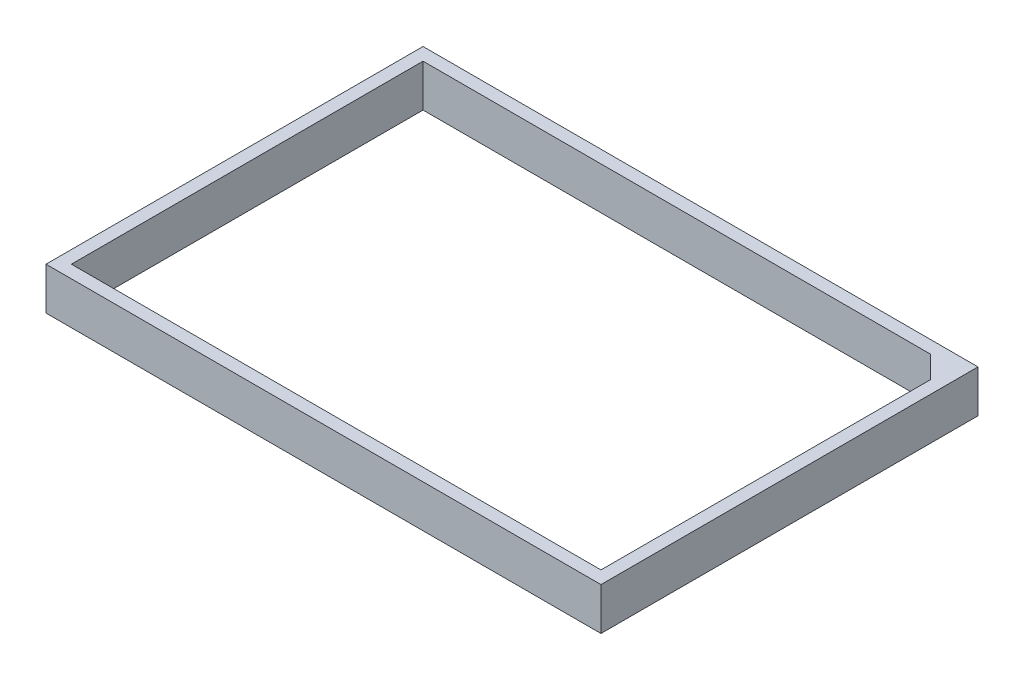
from build123d import *

# Parameters (mm, degrees)
SKETCH1_W           = 131
SKETCH1_H           = 89
BOSS_EXTRUDE1_DEPTH = 10
CUT_EXTRUDE1_DEPTH  = 100


with BuildPart() as part:
    # Sketch1 → Boss-Extrude1 (new body)
    with BuildSketch(Plane(origin=(0, 0, 0), x_dir=(1, 0, 0), z_dir=(0, 1, 0))):
        Rectangle(SKETCH1_W, SKETCH1_H)
    extrude(amount=BOSS_EXTRUDE1_DEPTH)

    # Sketch2 → Cut-Extrude1 (cut)
    # profile 1 of 2: a face of its own
    with BuildSketch(Plane(origin=(0, 10, 0), x_dir=(1, 0, 0), z_dir=(0, 1, 0))):
        Polygon((-62.5, 41.5), (-62.5, -41.5), (62.5, -41.5), (62.5, 36.324264069), (57.324264069, 41.5), align=None)
        Polygon((62.2, -41.2), (62.2, 36.2), (57.2, 41.2), (-62.2, 41.2), (-62.2, -41.2), align=None, mode=Mode.SUBTRACT)
    # profile 2 of 2: a face of its own
    with BuildSketch(Plane(origin=(0, 10, 0), x_dir=(1, 0, 0), z_dir=(0, 1, 0))):
        Polygon((-62.2, -41.2), (62.2, -41.2), (62.2, 36.2), (57.2, 41.2), (-62.2, 41.2), align=None)
    extrude(amount=-CUT_EXTRUDE1_DEPTH, mode=Mode.SUBTRACT)


solid = part.part
